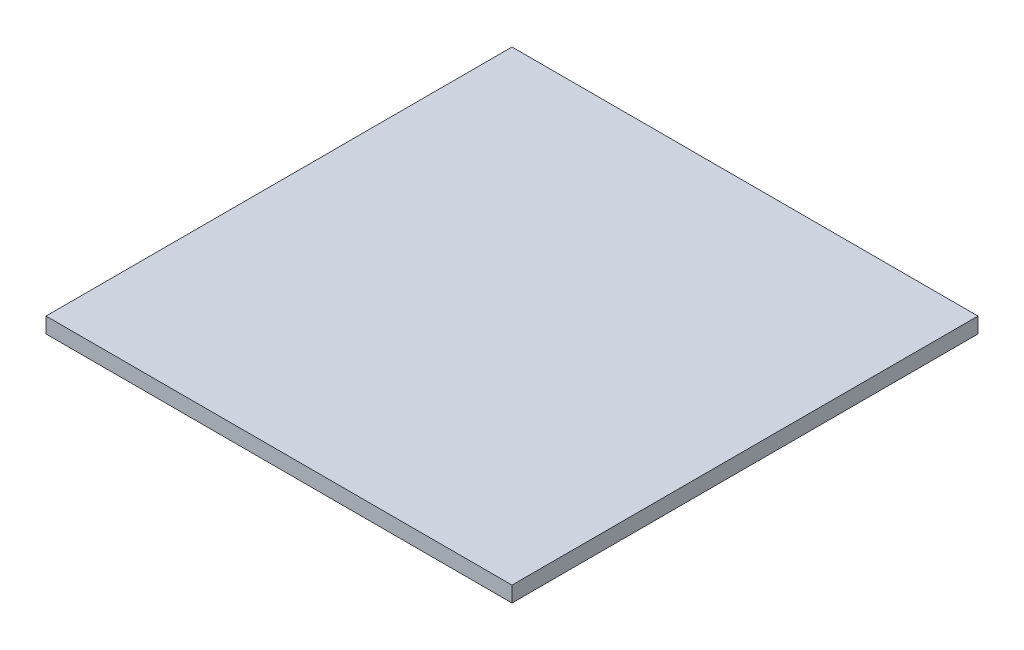
from build123d import *

# Parameters (mm, degrees)
SKETCH1_W           = 3000
SKETCH1_H           = 3000
BOSS_EXTRUDE1_DEPTH = 100


with BuildPart() as part:
    # Sketch1 → Boss-Extrude1 (new body)
    with BuildSketch(Plane(origin=(0, 0, 0), x_dir=(1, 0, 0), z_dir=(0, 1, 0))):
        Rectangle(SKETCH1_W, SKETCH1_H)
    extrude(amount=BOSS_EXTRUDE1_DEPTH)


solid = part.part
